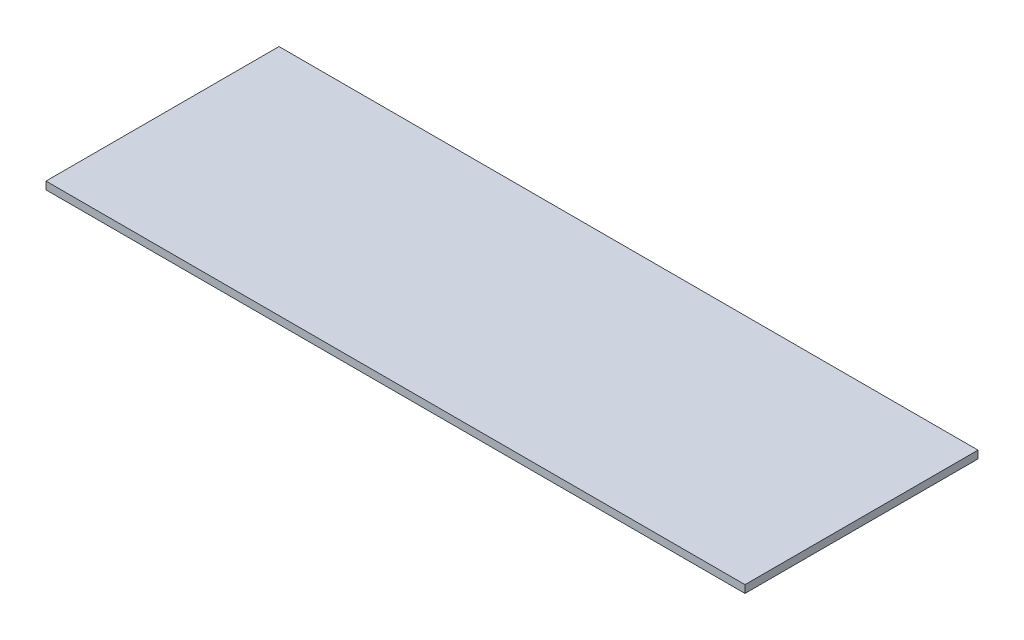
from build123d import *

# Parameters (mm, degrees)
SKETCH1_W           = 914.4
SKETCH1_H           = 304.8
BOSS_EXTRUDE1_DEPTH = 10


with BuildPart() as part:
    # Sketch1 → Boss-Extrude1 (new body)
    with BuildSketch(Plane(origin=(0, 0, 0), x_dir=(1, 0, 0), z_dir=(0, 1, 0))):
        Rectangle(SKETCH1_W, SKETCH1_H)
    extrude(amount=BOSS_EXTRUDE1_DEPTH)


solid = part.part
